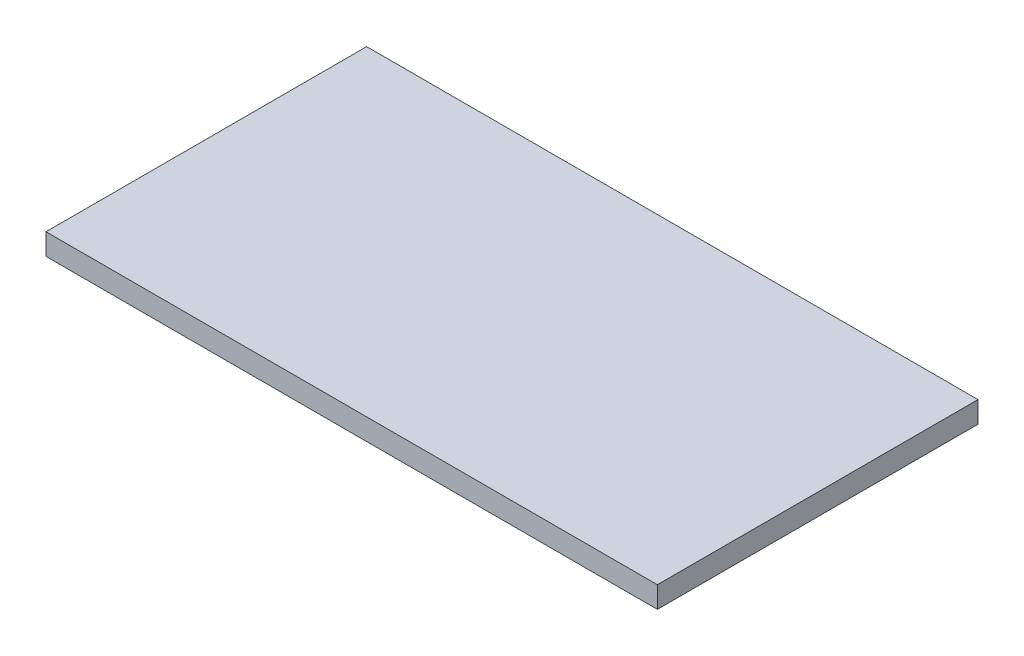
from build123d import *

# Parameters (mm, degrees)
PCB_W               = 28.6
PCB_H               = 15
BOSS_EXTRUDE1_DEPTH = 1


with BuildPart() as part:
    # PCB → Boss-Extrude1 (new body)
    with BuildSketch(Plane(origin=(0, 0, 0), x_dir=(1, 0, 0), z_dir=(0, 1, 0))):
        with Locations((14.3, -7.5)):
            Rectangle(PCB_W, PCB_H)
    extrude(amount=BOSS_EXTRUDE1_DEPTH)


solid = part.part
